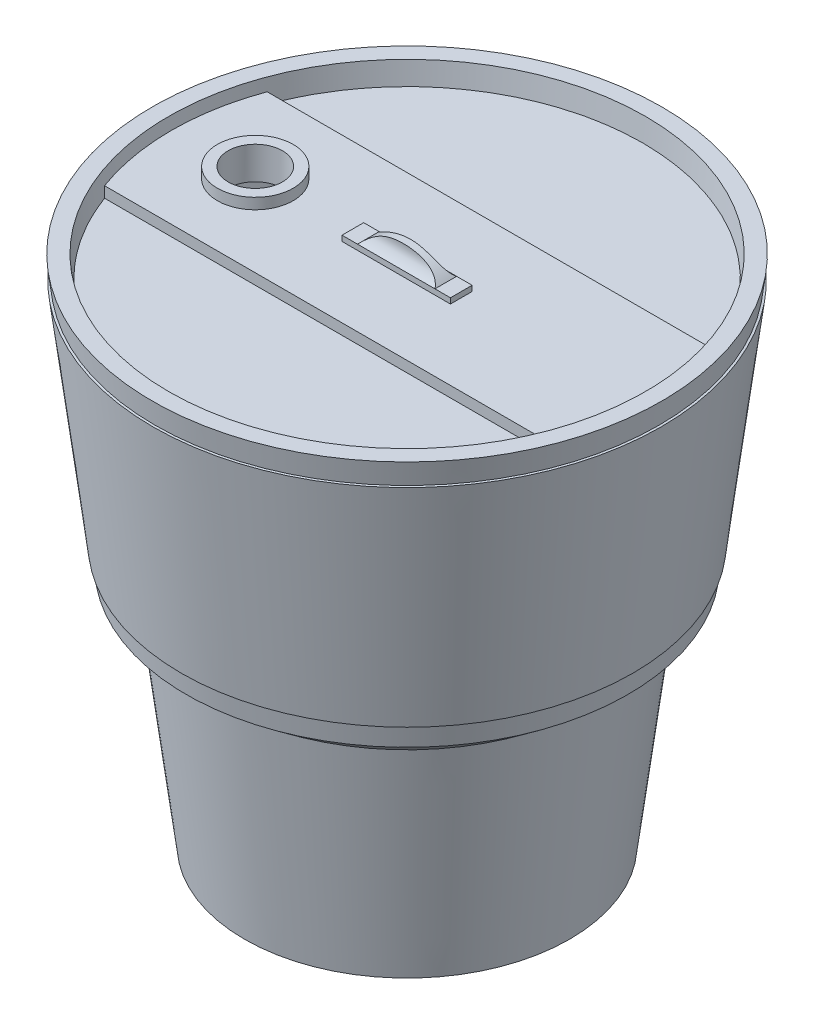
from build123d import *

# Parameters (mm, degrees)
SKETCH2_R           = 13
CUT_EXTRUDE1_DEPTH  = 1
CUT_EXTRUDE1_DRAFT  = -45
BOSS_EXTRUDE1_DEPTH = 1
SKETCH7_R           = 3.5
BOSS_EXTRUDE2_DEPTH = 1
SKETCH8_R           = 2.5
CUT_EXTRUDE2_DEPTH  = 19
BOSS_EXTRUDE3_DEPTH = 1
CUT_EXTRUDE3_DEPTH  = 7.5


with BuildPart() as part:
    # Sketch1 → Revolve1 (revolve)
    with BuildSketch(Plane.XY):
        Polygon((0, 47.236111111), (23.5, 47.236111111), (20.375, 22.236111111), (17.5, 20), (15, 0), (0, 0), align=None)
    revolve(axis=Axis((0, 0, 0), (0, 1, 0)))


with BuildPart() as cut_extrude1_tool:
    # Sketch2 → Cut-Extrude1 (with draft: the straight prism first)
    with BuildSketch(Plane.XZ):
        Circle(SKETCH2_R)
    extrude(amount=-CUT_EXTRUDE1_DEPTH)
    # Cut-Extrude1: the draft: its side faces are tilted about the plane it starts from
    cut_extrude1_sides = [cut_extrude1_tool.faces().sort_by_distance(p)[0] for p in [
        (-13, 0.5, 0),
    ]]
    draft(cut_extrude1_sides, Plane.XZ, CUT_EXTRUDE1_DRAFT)


with BuildPart() as part_1:
    add(part.part)

    # Cut-Extrude1: cut by cut_extrude1_tool
    add(cut_extrude1_tool.part, mode=Mode.SUBTRACT)

    # Sketch3 → Cut-Revolve1 (revolve, cut)
    with BuildSketch(Plane.XY):
        Polygon((-22.746108891, 45.236111111), (-20.121108891, 24.236111111), (-20.815703404, 24.149286797), (-23.440703404, 45.149286797), align=None)
    revolve(axis=Axis((0, 0, 0), (0, 1, 0)), mode=Mode.SUBTRACT)

    # Sketch4 → Cut-Revolve2 (revolve, cut)
    with BuildSketch(Plane.XY):
        Polygon((0, 51.679010238), (22.543689063, 51.679010238), (18.809061476, 21.80198954), (16.492217781, 20), (14.179717781, 1.5), (0, 1.5), align=None)
    revolve(axis=Axis((0, 0, 0), (0, 1, 0)), mode=Mode.SUBTRACT)


with BuildPart() as body_2:
    # Sketch3<2> → Revolve2 (revolve)
    with BuildSketch(Plane.XY):
        Polygon((-22.746108891, 45.236111111), (-20.121108891, 24.236111111), (-20.815703404, 24.149286797), (-23.440703404, 45.149286797), align=None)
    revolve(axis=Axis((0, 0, 0), (0, 1, 0)))


with BuildPart() as body_3:
    # Sketch5 → Revolve3 (revolve)
    with BuildSketch(Plane.XY):
        Polygon((0, 45.236111111), (21.738326672, 45.236111111), (21.613326672, 44.236111111), (0, 44.236111111), align=None)
    revolve(axis=Axis((0, 0, 0), (0, 1, 0)))

    # Sketch6 → Boss-Extrude1 (add)
    with BuildSketch(Plane(origin=(0, 45.236111111, 0), x_dir=(1, 0, 0), z_dir=(0, 1, 0))):
        with BuildLine():
            Line((20.403549851, -7.5), (-20.403549851, -7.5))
            ThreePointArc((-20.403549851, -7.5), (-21.738326672, 0), (-20.403549851, 7.5))
            Line((-20.403549851, 7.5), (20.403549851, 7.5))
            ThreePointArc((20.403549851, 7.5), (21.738326672, 0), (20.403549851, -7.5))
        make_face()
    extrude(amount=BOSS_EXTRUDE1_DEPTH)

    # Sketch7 → Boss-Extrude2 (add)
    with BuildSketch(Plane(origin=(0, 46.236111111, 0), x_dir=(1, 0, 0), z_dir=(0, 1, 0))):
        with Locations((-14, 0)):
            Circle(SKETCH7_R)
    extrude(amount=BOSS_EXTRUDE2_DEPTH)

    # Sketch8 → Cut-Extrude2 (cut)
    with BuildSketch(Plane(origin=(0, 47.236111111, 0), x_dir=(1, 0, 0), z_dir=(0, 1, 0))):
        with Locations((-14, 0)):
            Circle(SKETCH8_R)
    extrude(amount=-CUT_EXTRUDE2_DEPTH, mode=Mode.SUBTRACT)

    # Sketch9 → Boss-Extrude3 (add, symmetric)
    with BuildSketch(Plane.XY):
        with BuildLine():
            Line((-5, 46.236111111), (-5, 46.736111111))
            Line((-5, 46.736111111), (-3.570714214, 46.736111111))
            ThreePointArc((-3.570714214, 46.736111111), (0, 48.236111111), (3.570714214, 46.736111111))
            Line((3.570714214, 46.736111111), (5, 46.736111111))
            Line((5, 46.736111111), (5, 46.236111111))
            Line((5, 46.236111111), (-5, 46.236111111))
        make_face()
    extrude(amount=BOSS_EXTRUDE3_DEPTH, both=True)

    # Sketch10 → Cut-Extrude3 (cut, symmetric)
    with BuildSketch(Plane(origin=(0, 0, 0), x_dir=(0, 0, -1), z_dir=(1, 0, 0))):
        with BuildLine():
            Line((-1, 46.736111111), (-2, 49.483588531))
            ThreePointArc((-2, 49.483588531), (-0.40612221, 48.507988776), (-1, 46.736111111))
        make_face()
        with BuildLine():
            Line((1, 46.736111111), (2, 49.483588531))
            ThreePointArc((2, 49.483588531), (0.40612221, 48.507988776), (1, 46.736111111))
        make_face()
    extrude(amount=CUT_EXTRUDE3_DEPTH, both=True, mode=Mode.SUBTRACT)


solid = Compound([part_1.part, body_2.part, body_3.part])
